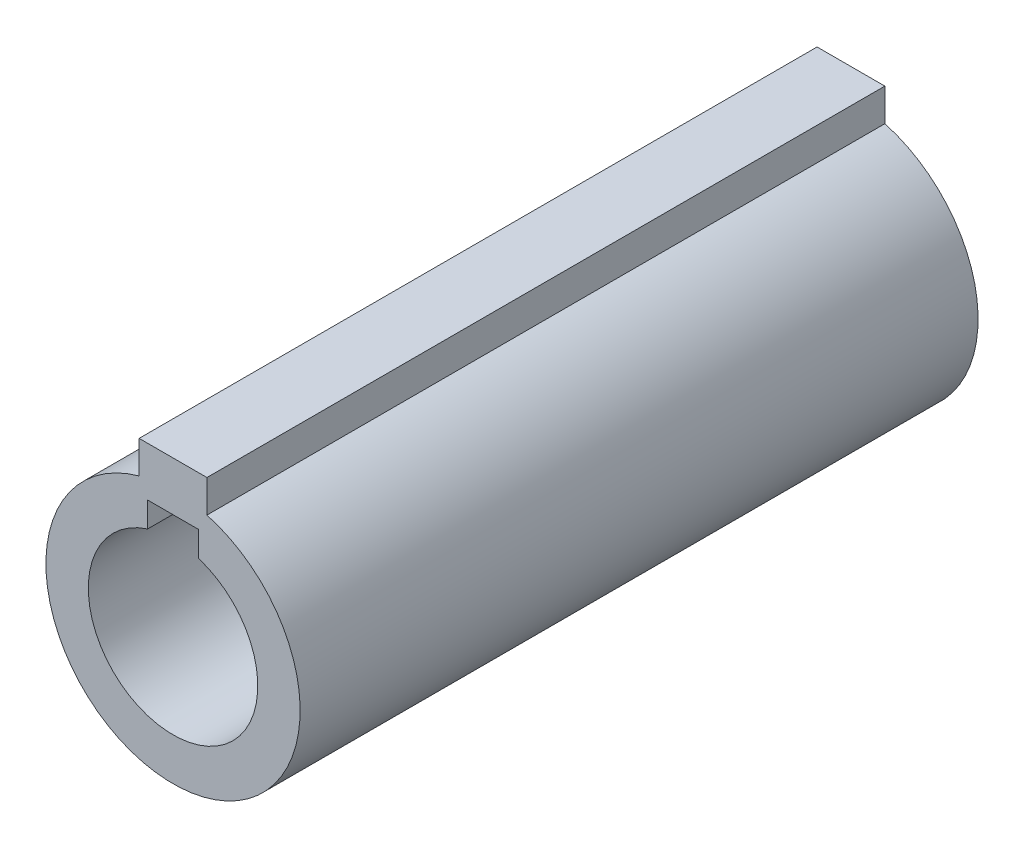
from build123d import *

# Parameters (mm, degrees)
EXTRUDE_1_DEPTH = 80


with BuildPart() as part:
    # 草图1 → 凸台-拉伸1 (new body)
    with BuildSketch(Plane.XY):
        with BuildLine():
            Line((-4, 18.3), (-4, 14.456832295))
            ThreePointArc((-4, 14.456832295), (0, -15), (4, 14.456832295))
            Line((4, 14.456832295), (4, 18.3))
            Line((4, 18.3), (-4, 18.3))
        make_face()
        with BuildLine():
            Line((-3, 9.539392014), (-3, 12.5))
            Line((-3, 12.5), (3, 12.5))
            Line((3, 12.5), (3, 9.539392014))
            ThreePointArc((3, 9.539392014), (0, -10), (-3, 9.539392014))
        make_face(mode=Mode.SUBTRACT)
    extrude(amount=EXTRUDE_1_DEPTH)


solid = part.part
